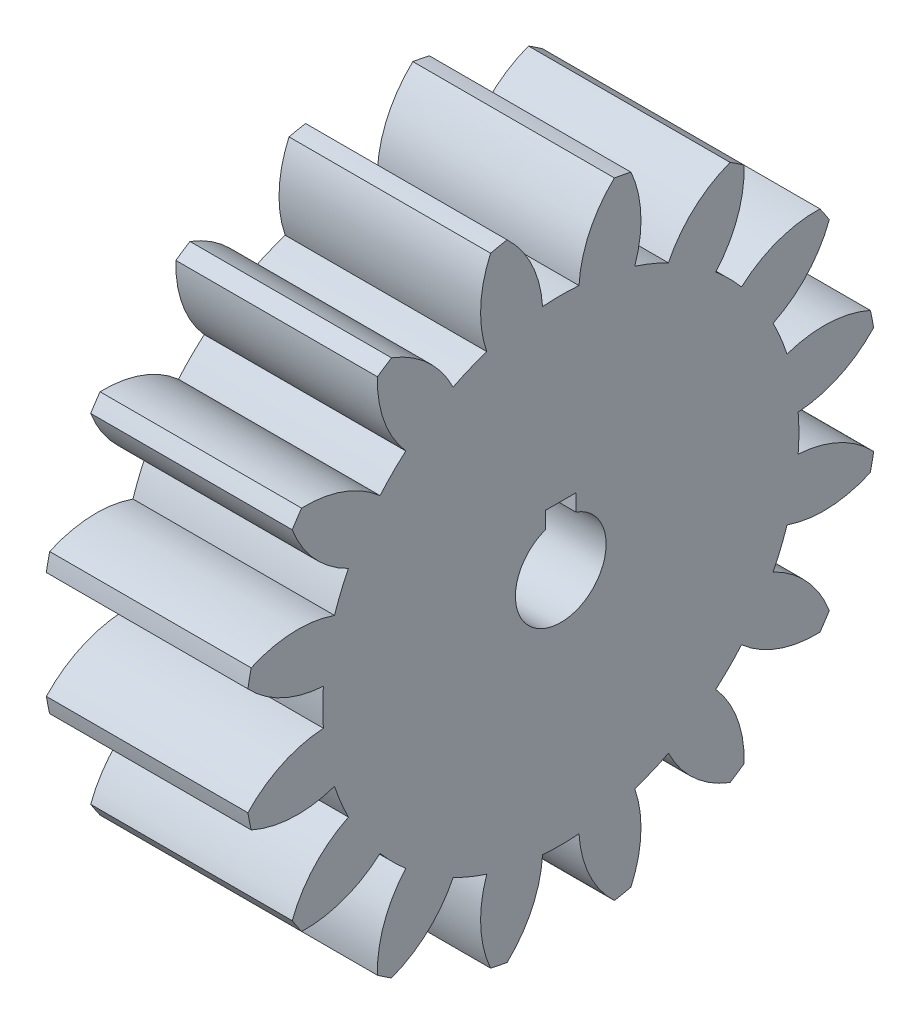
from build123d import *

# Parameters (mm, degrees)
BASPROSKE_W     = 40
BASPROSKE_H     = 63
TOOTHCUT_DEPTH  = 98.662684788
TEETHCUTS_COUNT = 16
TEETHCUTS_ANGLE = 337.5
BORSKE_R        = 9
BORE_DEPTH      = 50.0000508
KEYSKE_W        = 6
KEYSKE_H        = 11.8
KEYWAY_DEPTH    = 50.0000508


with BuildPart() as part:
    # BasProSke → Base-Revolve (revolve)
    with BuildSketch(Plane(origin=(0, 0, 0), x_dir=(1, 0, 0), z_dir=(0, 1, 0)), mode=Mode.PRIVATE) as base_revolve_sk:
        with Locations((20, 31.5)):
            Rectangle(BASPROSKE_W, BASPROSKE_H)
    revolve(base_revolve_sk.sketch.rotate(Axis((-10, 0, 0), (1, 0, 0)), 180), axis=Axis((-10, 0, 0), (1, 0, 0)))

    # TooCutSke → ToothCut (cut, through all)
    with BuildSketch(Plane(origin=(0, 0, 0), x_dir=(0, 0, -1), z_dir=(1, 0, 0))):
        with BuildLine():
            ThreePointArc((3.615180629, 47.110492144), (0, 47.249), (-3.615180629, 47.110492144))
            ThreePointArc((-3.615180629, 47.110492144), (-5.700474856, 55.289738645), (-10.664660821, 62.11655218))
            ThreePointArc((-10.664660821, 62.11655218), (0, 63.0254), (10.664660821, 62.11655218))
            ThreePointArc((10.664660821, 62.11655218), (5.700474856, 55.289738645), (3.615180629, 47.110492144))
        make_face()
    toothcut = extrude(amount=TOOTHCUT_DEPTH, mode=Mode.SUBTRACT)

    # TeethCuts: ToothCut ×16 about axis
    teethcuts_axis = Axis((-10, 0, 0), (1, 0, 0))
    for i in range(1, TEETHCUTS_COUNT):
        add(toothcut.rotate(teethcuts_axis, i * TEETHCUTS_ANGLE / (TEETHCUTS_COUNT - 1)), mode=Mode.SUBTRACT)

    # BorSke → Bore (cut, symmetric)
    with BuildSketch(Plane(origin=(0, 0, 0), x_dir=(0, 0, -1), z_dir=(1, 0, 0))):
        with Locations(Location((0, 0, 0), (0, 0, 180))):
            Circle(BORSKE_R)
    extrude(amount=BORE_DEPTH, both=True, mode=Mode.SUBTRACT)

    # KeySke → Keyway (cut, symmetric)
    with BuildSketch(Plane(origin=(0, 0, 0), x_dir=(0, 0, -1), z_dir=(1, 0, 0))):
        with Locations((0, 5.9)):
            Rectangle(KEYSKE_W, KEYSKE_H)
    extrude(amount=KEYWAY_DEPTH, both=True, mode=Mode.SUBTRACT)


solid = part.part
